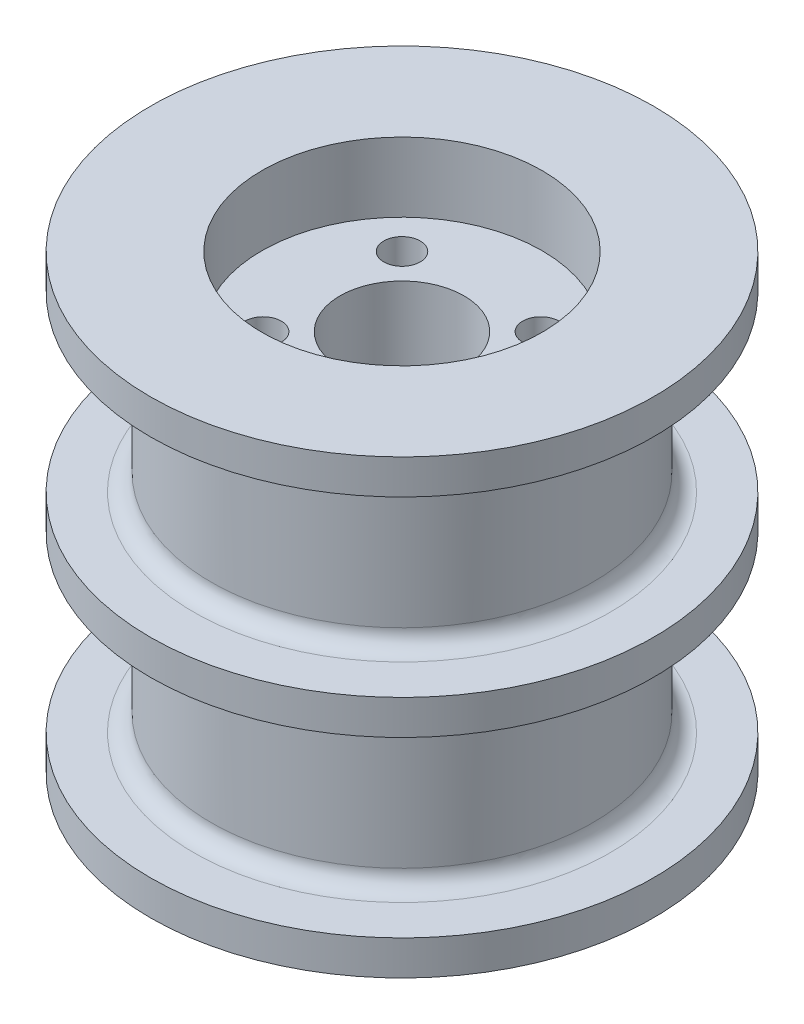
from build123d import *

# Parameters (mm, degrees)
SKETCH_2_R          = 2.1
CUT_EXTRUDE_1_DEPTH = 61.149812967
FILLET_1_R          = 2


with BuildPart() as part:
    # 草图1 → 旋转1 (revolve)
    with BuildSketch(Plane(origin=(0, 0, 0), x_dir=(0, 0, -1), z_dir=(1, 0, 0))):
        Polygon((-7.15, 44), (-16.15, 44), (-16.15, 52), (-29, 52), (-29, 48), (-22, 48), (-22, 28), (-29, 28), (-29, 24), (-22, 24), (-22, 4), (-29, 4), (-29, 0), (-16.15, 0), (-16.15, 8), (-7.15, 8), align=None)
    revolve(axis=Axis((0, 0, 0), (0, 1, 0)))

    # 草图2 → 切除-拉伸1 (cut, through all)
    with BuildSketch(Plane(origin=(0, 44, 0), x_dir=(1, 0, 0), z_dir=(0, 1, 0))):
        with Locations((-8, 8)):
            Circle(SKETCH_2_R)
        with Locations((8, 8)):
            Circle(SKETCH_2_R)
        with Locations((8, -8)):
            Circle(SKETCH_2_R)
        with Locations((-8, -8)):
            Circle(SKETCH_2_R)
    extrude(amount=-CUT_EXTRUDE_1_DEPTH, mode=Mode.SUBTRACT)

    # 圆角1
    fillet_1_edges = [part.edges().sort_by_distance(p)[0] for p in [
        (0, 24, -22),
        (0, 4, -22),
        (0, 48, -22),
        (0, 28, -22),
    ]]
    fillet(fillet_1_edges, radius=FILLET_1_R)


solid = part.part
